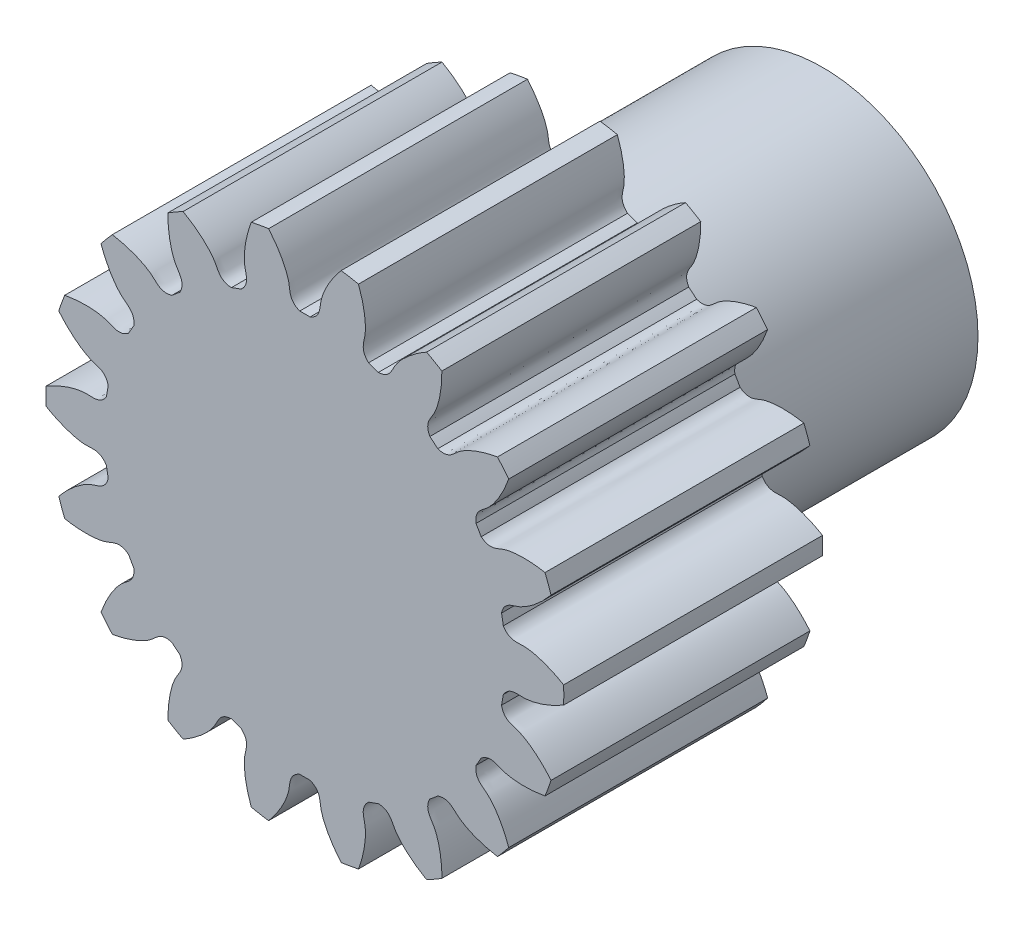
from build123d import *

# Parameters (mm, degrees)
SKETCH_1_R               = 5
EXTRUDE_1_DEPTH          = 5
CUT_EXTRUDE_1_DEPTH      = 9.660254038
PATTERN_CIRCULAR_1_COUNT = 18
SKETCH_4_R               = 3
EXTRUDE_2_DEPTH          = 5
SKETCH_5_R               = 1
CUT_EXTRUDE_2_DEPTH      = 5


with BuildPart() as part:
    # 草图1 → 凸台-拉伸1 (new body)
    with BuildSketch(Plane.XY):
        Circle(SKETCH_1_R)
    extrude(amount=EXTRUDE_1_DEPTH)

    # 草图2 → 切除-拉伸1 (cut, through all)
    with BuildSketch(Plane.XY):
        with BuildLine():
            ThreePointArc((0.09970178, 3.87371715), (0, 3.875), (-0.09970178, 3.87371715))
            add(Edge.make_bspline(
                [(-0.09970178, 3.87371715), (-0.30755202, 3.959340195), (-0.281394525, 4.119349751), (-0.315916457, 4.271297728), (-0.31937576, 4.2852533), (-0.323553797, 4.300770237), (-0.328512355, 4.317825091), (-0.334315015, 4.336392084), (-0.341023859, 4.356443666), (-0.348700427, 4.377950366), (-0.357405358, 4.400880864), (-0.367198437, 4.425201998), (-0.378138513, 4.450878789), (-0.39028346, 4.477874466), (-0.403690129, 4.50615049), (-0.418414299, 4.535666583), (-0.434510628, 4.566380752), (-0.452032612, 4.598249322), (-0.471032538, 4.631226962), (-0.491561435, 4.66526672), (-0.513669036, 4.700320051), (-0.537403731, 4.736336856), (-0.562812528, 4.77326551), (-0.589941007, 4.811052903), (-0.618833286, 4.849644473), (-0.649531974, 4.888984245), (-0.682078137, 4.929014872), (-0.716511262, 4.969677669), (-0.752869213, 5.010912657), (-0.791188202, 5.052658607), (-0.831502751, 5.094853076), (-0.87384566, 5.137432457), (-0.918247973, 5.180332018), (-0.964738945, 5.223485948), (-1.013346016, 5.266827406), (-1.064094777, 5.310288565), (-1.117008944, 5.353800659), (-1.17211033, 5.39729403), (-1.22941882, 5.440698182), (-1.288952349, 5.483941823), (-1.350726862, 5.526952923), (-1.437037676, 5.584519758), (-1.503777719, 5.626166889), (-1.549280445, 5.65333919)],
                knots=[0, 0, 0, 0, 0.187591972, 0.192996016, 0.1991206, 0.205965723, 0.213531386, 0.221817587, 0.230824328, 0.240551609, 0.250999428, 0.262167787, 0.274056685, 0.286666122, 0.299996099, 0.314046614, 0.32881767, 0.344309264, 0.360521397, 0.37745407, 0.395107283, 0.413481034, 0.432575325, 0.452390155, 0.472925524, 0.494181432, 0.51615788, 0.538854867, 0.562272393, 0.586410459, 0.611269064, 0.636848208, 0.663147891, 0.690168114, 0.717908876, 0.746370177, 0.775552017, 0.805454397, 0.836077316, 0.867420774, 0.899484772, 0.932269309, 1, 1, 1, 1], degree=3))
            ThreePointArc((-1.549280445, 5.65333919), (0, 5.86178419), (1.549280445, 5.65333919))
            add(Edge.make_bspline(
                [(0.09970178, 3.87371715), (0.30755202, 3.959340195), (0.281394525, 4.119349751), (0.315916457, 4.271297728), (0.31937576, 4.2852533), (0.323553797, 4.300770237), (0.328512355, 4.317825091), (0.334315015, 4.336392084), (0.341023859, 4.356443666), (0.348700427, 4.377950366), (0.357405358, 4.400880864), (0.367198437, 4.425201998), (0.378138513, 4.450878789), (0.39028346, 4.477874466), (0.403690129, 4.50615049), (0.418414299, 4.535666583), (0.434510628, 4.566380752), (0.452032612, 4.598249322), (0.471032538, 4.631226962), (0.491561435, 4.66526672), (0.513669036, 4.700320051), (0.537403731, 4.736336856), (0.562812528, 4.77326551), (0.589941007, 4.811052903), (0.618833286, 4.849644473), (0.649531974, 4.888984245), (0.682078137, 4.929014872), (0.716511262, 4.969677669), (0.752869213, 5.010912657), (0.791188202, 5.052658607), (0.831502751, 5.094853076), (0.87384566, 5.137432457), (0.918247973, 5.180332018), (0.964738945, 5.223485948), (1.013346016, 5.266827406), (1.064094777, 5.310288565), (1.117008944, 5.353800659), (1.17211033, 5.39729403), (1.22941882, 5.440698182), (1.288952349, 5.483941823), (1.350726862, 5.526952923), (1.437037676, 5.584519758), (1.503777719, 5.626166889), (1.549280445, 5.65333919)],
                knots=[0, 0, 0, 0, 0.187591972, 0.192996016, 0.1991206, 0.205965723, 0.213531386, 0.221817587, 0.230824328, 0.240551609, 0.250999428, 0.262167787, 0.274056685, 0.286666122, 0.299996099, 0.314046614, 0.32881767, 0.344309264, 0.360521397, 0.37745407, 0.395107283, 0.413481034, 0.432575325, 0.452390155, 0.472925524, 0.494181432, 0.51615788, 0.538854867, 0.562272393, 0.586410459, 0.611269064, 0.636848208, 0.663147891, 0.690168114, 0.717908876, 0.746370177, 0.775552017, 0.805454397, 0.836077316, 0.867420774, 0.899484772, 0.932269309, 1, 1, 1, 1], degree=3))
        make_face()
    cut_extrude_1 = extrude(amount=CUT_EXTRUDE_1_DEPTH, mode=Mode.SUBTRACT)

    # 阵列(圆周)1: 切除-拉伸1 ×18 about axis
    pattern_circular_1_axis = Axis((0, 0, 5), (0, 0, -1))
    for i in range(1, PATTERN_CIRCULAR_1_COUNT):
        add(cut_extrude_1.rotate(pattern_circular_1_axis, i * 360 / PATTERN_CIRCULAR_1_COUNT), mode=Mode.SUBTRACT)

    # 草图4 → 凸台-拉伸2 (add)
    with BuildSketch(Plane(origin=(0, 0, 0), x_dir=(-1, 0, 0), z_dir=(0, 0, -1))):
        Circle(SKETCH_4_R)
    extrude(amount=EXTRUDE_2_DEPTH)

    # 草图5 → 切除-拉伸2 (cut)
    with BuildSketch(Plane(origin=(0, 0, -5), x_dir=(-1, 0, 0), z_dir=(0, 0, -1))):
        Circle(SKETCH_5_R)
    extrude(amount=-CUT_EXTRUDE_2_DEPTH, mode=Mode.SUBTRACT)


solid = part.part
